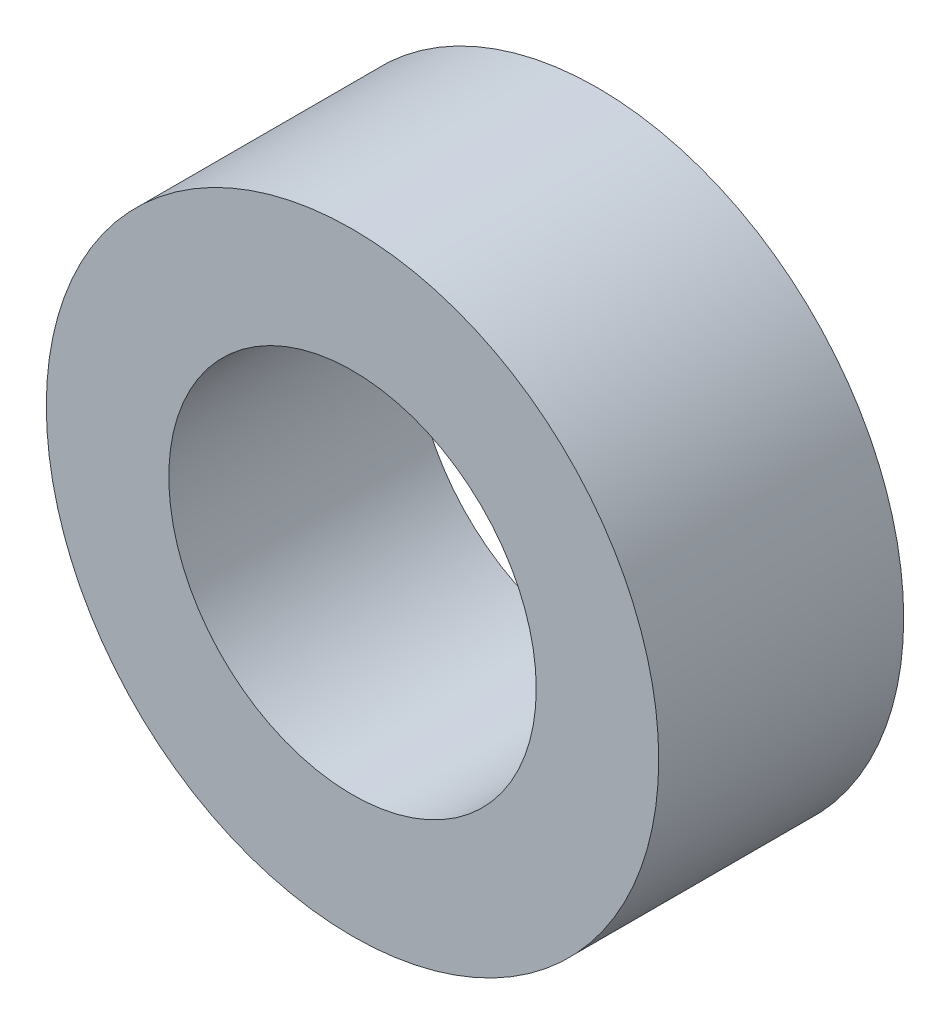
from build123d import *

# Parameters (mm, degrees)
SKETCH1_R           = 7.5
SKETCH1_R_2         = 4.5
BOSS_EXTRUDE1_DEPTH = 6


with BuildPart() as part:
    # Sketch1 → Boss-Extrude1 (new body)
    with BuildSketch(Plane.XY):
        Circle(SKETCH1_R)
        Circle(SKETCH1_R_2, mode=Mode.SUBTRACT)
    extrude(amount=BOSS_EXTRUDE1_DEPTH)


solid = part.part
